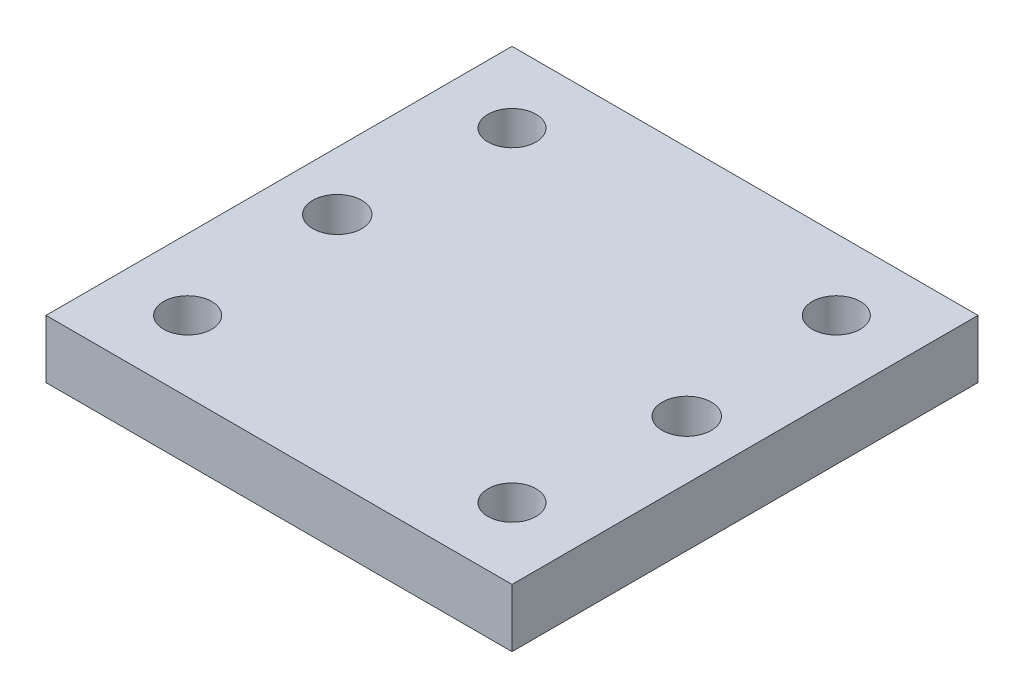
from build123d import *

# Parameters (mm, degrees)
SKETCH1_W               = 101.6
SKETCH1_H               = 101.6
BOSS_EXTRUDE1_DEPTH     = 12.7
M10_CLEARANCE_HOLE1_D   = 10.5
F_1_2_13_TAPPED_HOLE1_D = 10.71626


with BuildPart() as part:
    # Sketch1 → Boss-Extrude1 (new body)
    with BuildSketch(Plane(origin=(0, 0, 0), x_dir=(1, 0, 0), z_dir=(0, 1, 0))):
        with Locations((50.8, 50.8)):
            Rectangle(SKETCH1_W, SKETCH1_H)
    extrude(amount=BOSS_EXTRUDE1_DEPTH)

    # M10 Clearance Hole1 (through all)
    with Locations(Plane(origin=(0, 12.7, 0), x_dir=(1, 0, 0), z_dir=(0, 1, 0))):
        with Locations((86.155339059, 86.155339059), (86.155339059, 15.444660941), (15.444660941, 86.155339059), (15.444660941, 15.444660941)):
            Hole(M10_CLEARANCE_HOLE1_D / 2)

    # 1/2-13 Tapped Hole1 (through all)
    with Locations(Plane(origin=(0, 12.7, 0), x_dir=(1, 0, 0), z_dir=(0, 1, 0))):
        with Locations((88.9, 50.8), (12.7, 50.8)):
            Hole(F_1_2_13_TAPPED_HOLE1_D / 2)


solid = part.part
